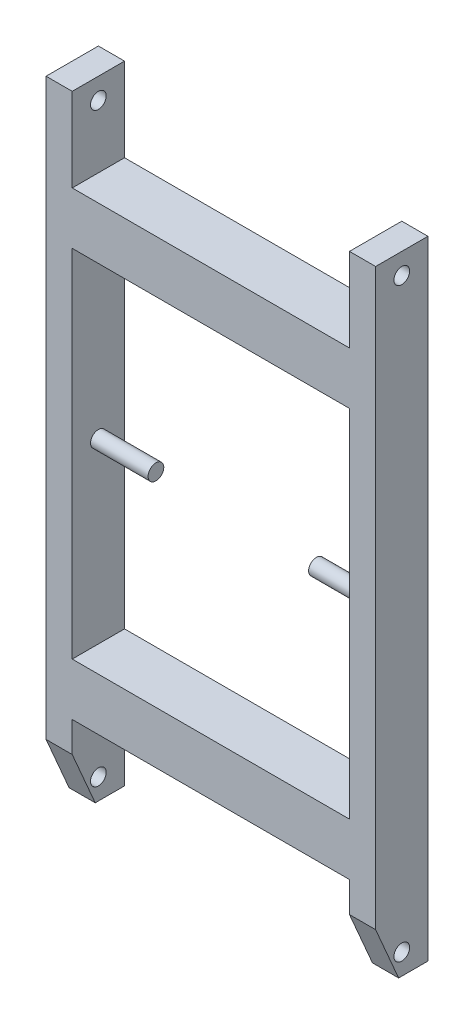
from build123d import *

# Parameters (mm, degrees)
SKETCH1_W               = 265
SKETCH1_H               = 340
BOSS_EXTRUDE1_DEPTH     = 50
SKETCH2_R               = 7.5
BOSS_EXTRUDE2_DEPTH     = 80
SKETCH7_R               = 7.5
BOSS_EXTRUDE3_DEPTH     = 80
SKETCH8_R               = 7.5
CUT_EXTRUDE1_DEPTH      = 410
SKETCH9_R               = 7.5
CUT_EXTRUDE2_DEPTH      = 410
CUT_EXTRUDE4_DEPTH      = 463.803826299
CUT_EXTRUDE4_DEPTH_BACK = 463.803826299


with BuildPart() as part:
    # Sketch1 → Boss-Extrude1 (new body)
    with BuildSketch(Plane.XY):
        Polygon((-7.287721529, 248.848476773), (17.712278471, 248.848476773), (17.712278471, -351.151523227), (-7.287721529, -351.151523227), (-7.287721529, -271.151523227), (-272.287721529, -271.151523227), (-272.287721529, -351.151523227), (-297.287721529, -351.151523227), (-297.287721529, 248.848476773), (-272.287721529, 248.848476773), (-272.287721529, 168.848476773), (-7.287721529, 168.848476773), align=None)
        with Locations((-139.787721529, -51.151523227)):
            Rectangle(SKETCH1_W, SKETCH1_H, mode=Mode.SUBTRACT)
    extrude(amount=BOSS_EXTRUDE1_DEPTH)

    # Sketch2 → Boss-Extrude2 (add)
    with BuildSketch(Plane(origin=(17.712278471, 0, 0), x_dir=(0, 0, -1), z_dir=(1, 0, 0))):
        with Locations((-26.558504248, -51.151523227)):
            Circle(SKETCH2_R)
    extrude(amount=-BOSS_EXTRUDE2_DEPTH)

    # Sketch7 → Boss-Extrude3 (add)
    with BuildSketch(Plane.ZY.offset(297.287721529)):
        with Locations((25, -51.151523227)):
            Circle(SKETCH7_R)
    extrude(amount=-BOSS_EXTRUDE3_DEPTH)

    # Sketch8 → Cut-Extrude1 (cut)
    with BuildSketch(Plane.ZY.offset(297.287721529)):
        with Locations((25, -331.151523227)):
            Circle(SKETCH8_R)
    extrude(amount=-CUT_EXTRUDE1_DEPTH, mode=Mode.SUBTRACT)

    # Sketch9 → Cut-Extrude2 (cut)
    with BuildSketch(Plane.ZY.offset(297.287721529)):
        with Locations((25, 228.848476773)):
            Circle(SKETCH9_R)
    extrude(amount=-CUT_EXTRUDE2_DEPTH, mode=Mode.SUBTRACT)

    # Sketch11 → Cut-Extrude4 (cut, two sides: drawn at the far end of the back side and taken through both)
    with BuildSketch(Plane(origin=(0, 0, 0), x_dir=(0, 0, -1), z_dir=(1, 0, 0)).offset(-CUT_EXTRUDE4_DEPTH_BACK)):
        Polygon((-50, -351.151523227), (-28, -351.151523227), (-50, -300.151523227), align=None)
    extrude(amount=CUT_EXTRUDE4_DEPTH + CUT_EXTRUDE4_DEPTH_BACK, mode=Mode.SUBTRACT)


solid = part.part
